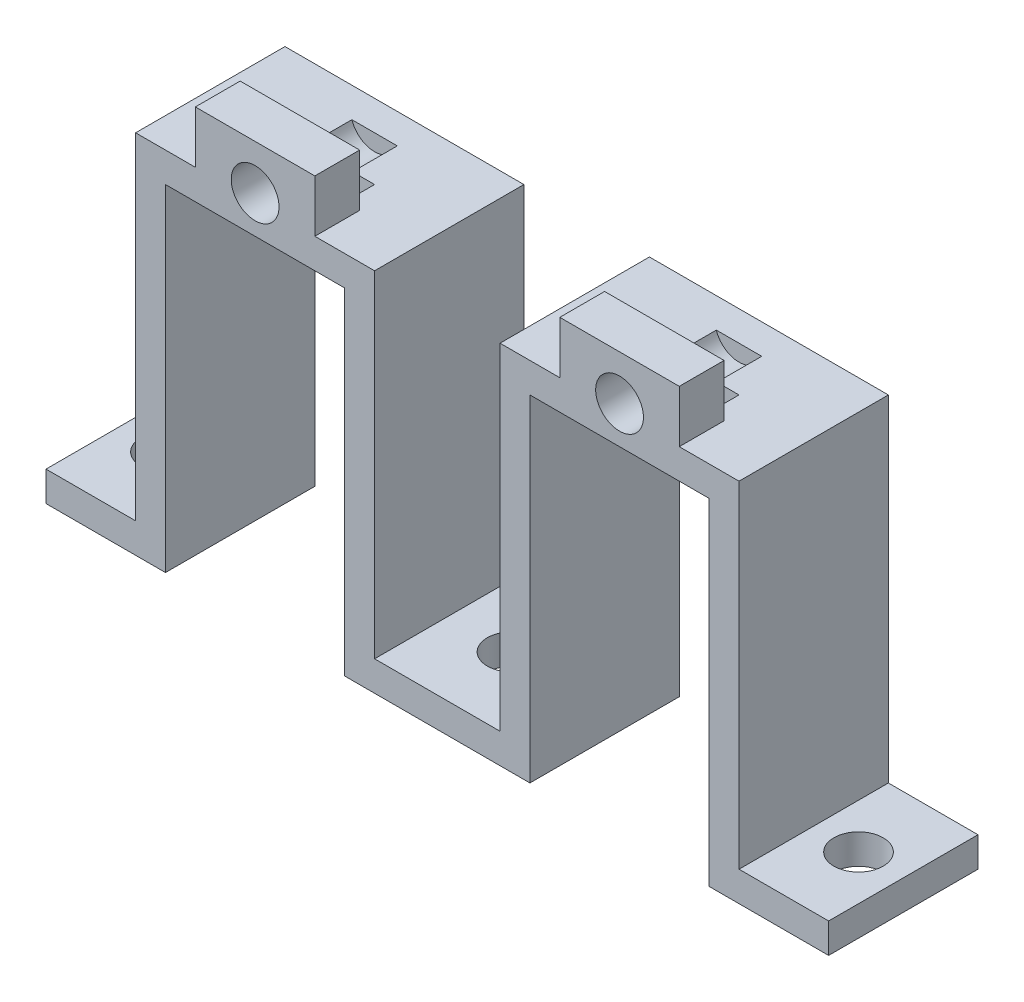
from build123d import *

# Parameters (mm, degrees)
EXTRUIR_L_MINA1_DEPTH   = 10
CROQUIS2_W              = 8
CROQUIS2_H              = 3.5
SALIENTE_EXTRUIR1_DEPTH = 3
CROQUIS3_R              = 1.65
CORTAR_EXTRUIR1_DEPTH   = 40.628777422
CROQUIS4_R              = 1.6
CORTAR_EXTRUIR2_DEPTH   = 8
CROQUIS6_W              = 6
CROQUIS6_H              = 2
CORTAR_EXTRUIR3_DEPTH   = 38.238286749


with BuildPart() as part:
    # Croquis1 → Extruir-Lámina1 (new body)
    with BuildSketch(Plane.XY):
        Polygon((26.2, 0), (18.2, 0), (18.2, 22.5), (6.2, 22.5), (6.2, 0), (-6.2, 0), (-6.2, 22.5), (-18.2, 22.5), (-18.2, 0), (-26.2, 0), (-26.2, 2), (-20.2, 2), (-20.2, 24.5), (-4.2, 24.5), (-4.2, 2), (4.2, 2), (4.2, 24.5), (20.2, 24.5), (20.2, 2), (26.2, 2), align=None)
    extrude(amount=EXTRUIR_L_MINA1_DEPTH)

    # Croquis2 → Saliente-Extruir1 (add)
    with BuildSketch(Plane.XY.offset(10)):
        with Locations((-12.2, 26.25)):
            Rectangle(CROQUIS2_W, CROQUIS2_H)
    saliente_extruir1 = extrude(amount=-SALIENTE_EXTRUIR1_DEPTH)

    # Simetría1: Saliente-Extruir1 across plane
    add(saliente_extruir1.mirror(Plane(origin=(0, 0, 0), x_dir=(0, 0, 1), z_dir=(1, 0, 0))))

    # Croquis3 → Cortar-Extruir1 (cut, through all)
    with BuildSketch(Plane(origin=(0, 0, 0), x_dir=(-1, 0, 0), z_dir=(0, -1, 0))):
        with Locations(Location((0, -5, 0), (0, 0, 90))):
            Circle(CROQUIS3_R)
        with Locations(Location((23.2, -5, 0), (0, 0, 90))):
            Circle(CROQUIS3_R)
        with Locations(Location((-23.2, -5, 0), (0, 0, 90))):
            Circle(CROQUIS3_R)
    extrude(amount=-CORTAR_EXTRUIR1_DEPTH, mode=Mode.SUBTRACT)

    # Croquis4 → Cortar-Extruir2 (cut)
    with BuildSketch(Plane.XY.offset(10)):
        with Locations((-12.2, 25)):
            Circle(CROQUIS4_R)
    cortar_extruir2 = extrude(amount=-CORTAR_EXTRUIR2_DEPTH, mode=Mode.SUBTRACT)

    # Croquis6 → Cortar-Extruir3 (cut, through all)
    with BuildSketch(Plane(origin=(0, 24.5, 0), x_dir=(1, 0, 0), z_dir=(0, 1, 0))):
        with Locations((-12.2, -6)):
            Rectangle(CROQUIS6_W, CROQUIS6_H)
    cortar_extruir3 = extrude(amount=-CORTAR_EXTRUIR3_DEPTH, mode=Mode.SUBTRACT)

    # Simetría2: Cortar-Extruir2, Cortar-Extruir3 across plane
    add(cortar_extruir2.mirror(Plane(origin=(0, 0, 0), x_dir=(0, 0, 1), z_dir=(1, 0, 0))), mode=Mode.SUBTRACT)
    add(cortar_extruir3.mirror(Plane(origin=(0, 0, 0), x_dir=(0, 0, 1), z_dir=(1, 0, 0))), mode=Mode.SUBTRACT)


solid = part.part
